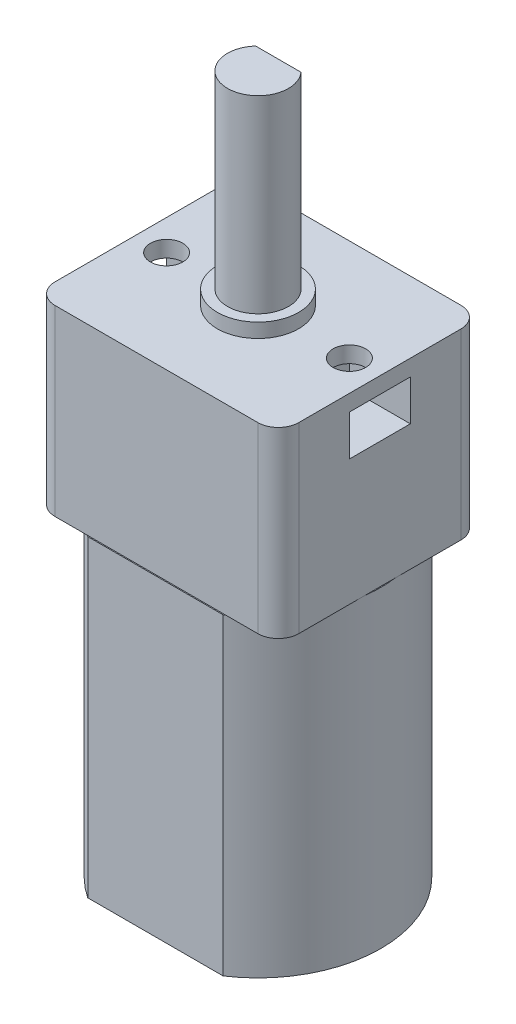
from build123d import *

# Parameters (mm, degrees)
GEARBOX_DEPTH                            = 9
AXLE_MOUNT_HOLE_BASE_SKETCH_R            = 0.8
SCREW_HOLES_DEPTH                        = 0.8
SCREW_ROOM_BASE_W                        = 3
SCREW_ROOM_BASE_H                        = 3
SCREW_ROOM_DEPTH                         = 2
AXLE_MOUNT_HOLE_BASE_SKETCH_3_R          = 2
AXLE_BASE_DEPTH                          = 0.7
SKETCH4_R                                = 1.5
AXLE_NON_NOTCHED_DEPTH                   = 0.3
AXLE_NOTCHED_DEPTH                       = 9
MOTOR_DEPTH                              = 15.4
REAR_AXLE_BEARING_TERMINAL_BASE_SKETCH_R = 2.5
REAR_AXLE_BEARING_DEPTH                  = 0.8
REAR_AXLE_BEARING_TERMINAL_BASE_SK_2_W   = 0.4
REAR_AXLE_BEARING_TERMINAL_BASE_SK_2_H   = 2
TERMINALS_DEPTH                          = 1.8


with BuildPart() as part:
    # Gearbox base sketch → Gearbox (new body)
    with BuildSketch(Plane(origin=(0, 0, 0), x_dir=(1, 0, 0), z_dir=(0, 1, 0))):
        with BuildLine():
            Line((-4.992296279, 5), (4.992296279, 5))
            ThreePointArc((4.992296279, 5), (5.704850414, 4.704850414), (6, 3.992296279))
            Line((6, 3.992296279), (6, -3.992296279))
            ThreePointArc((6, -3.992296279), (5.704850414, -4.704850414), (4.992296279, -5))
            Line((4.992296279, -5), (-4.992296279, -5))
            ThreePointArc((-4.992296279, -5), (-5.704850414, -4.704850414), (-6, -3.992296279))
            Line((-6, -3.992296279), (-6, 3.992296279))
            ThreePointArc((-6, 3.992296279), (-5.704850414, 4.704850414), (-4.992296279, 5))
        make_face()
    extrude(amount=GEARBOX_DEPTH)

    # Axle & mount hole base sketch → Screw holes (cut)
    with BuildSketch(Plane(origin=(0, 9, 0), x_dir=(1, 0, 0), z_dir=(0, 1, 0))):
        with Locations((4.5, 0)):
            Circle(AXLE_MOUNT_HOLE_BASE_SKETCH_R)
        with Locations((-4.5, 0)):
            Circle(AXLE_MOUNT_HOLE_BASE_SKETCH_R)
    extrude(amount=-SCREW_HOLES_DEPTH, mode=Mode.SUBTRACT)

    # Screw room base → Screw room (cut)
    with BuildSketch(Plane(origin=(0, 8.2, 0), x_dir=(1, 0, 0), z_dir=(0, 1, 0))):
        with Locations((-4.5, 0)):
            Rectangle(SCREW_ROOM_BASE_W, SCREW_ROOM_BASE_H)
        with Locations((4.5, 0)):
            Rectangle(SCREW_ROOM_BASE_W, SCREW_ROOM_BASE_H)
    extrude(amount=-SCREW_ROOM_DEPTH, mode=Mode.SUBTRACT)

    # Axle & mount hole base sketch<3> → Axle base (add)
    with BuildSketch(Plane(origin=(0, 9, 0), x_dir=(1, 0, 0), z_dir=(0, 1, 0))):
        Circle(AXLE_MOUNT_HOLE_BASE_SKETCH_3_R)
    extrude(amount=AXLE_BASE_DEPTH)

    # Sketch4 → Axle non-notched (add)
    with BuildSketch(Plane(origin=(0, 9.7, 0), x_dir=(1, 0, 0), z_dir=(0, 1, 0))):
        Circle(SKETCH4_R)
    extrude(amount=AXLE_NON_NOTCHED_DEPTH)

    # Axle notched base sketch → Axle notched (add)
    with BuildSketch(Plane(origin=(0, 10, 0), x_dir=(1, 0, 0), z_dir=(0, 1, 0))):
        with BuildLine():
            Line((1.118033989, 1), (-1.118033989, 1))
            ThreePointArc((-1.118033989, 1), (-0.535233135, -1.401258538), (1.5, 0))
            ThreePointArc((1.5, 0), (1.401258538, 0.535233135), (1.118033989, 1))
        make_face()
    extrude(amount=AXLE_NOTCHED_DEPTH)

    # Motor base sketch → Motor (add)
    with BuildSketch(Plane.XZ):
        with BuildLine():
            Line((3.33166625, 5.05), (-3.33166625, 5.05))
            ThreePointArc((-3.33166625, 5.05), (-6.05, 0), (-3.33166625, -5.05))
            Line((-3.33166625, -5.05), (3.33166625, -5.05))
            ThreePointArc((3.33166625, -5.05), (6.05, 0), (3.33166625, 5.05))
        make_face()
    extrude(amount=MOTOR_DEPTH)

    # Rear axle bearing _ terminal base sketch → Rear axle bearing (add)
    with BuildSketch(Plane.XZ.offset(15.4)):
        Circle(REAR_AXLE_BEARING_TERMINAL_BASE_SKETCH_R)
    extrude(amount=REAR_AXLE_BEARING_DEPTH)

    # Rear axle bearing _ terminal base sk 2 → Terminals (add)
    with BuildSketch(Plane.XZ.offset(15.4)):
        with Locations((-3.1, 0)):
            Rectangle(REAR_AXLE_BEARING_TERMINAL_BASE_SK_2_W, REAR_AXLE_BEARING_TERMINAL_BASE_SK_2_H)
        with Locations((3.1, 0)):
            Rectangle(REAR_AXLE_BEARING_TERMINAL_BASE_SK_2_W, REAR_AXLE_BEARING_TERMINAL_BASE_SK_2_H)
    extrude(amount=TERMINALS_DEPTH)


solid = part.part
